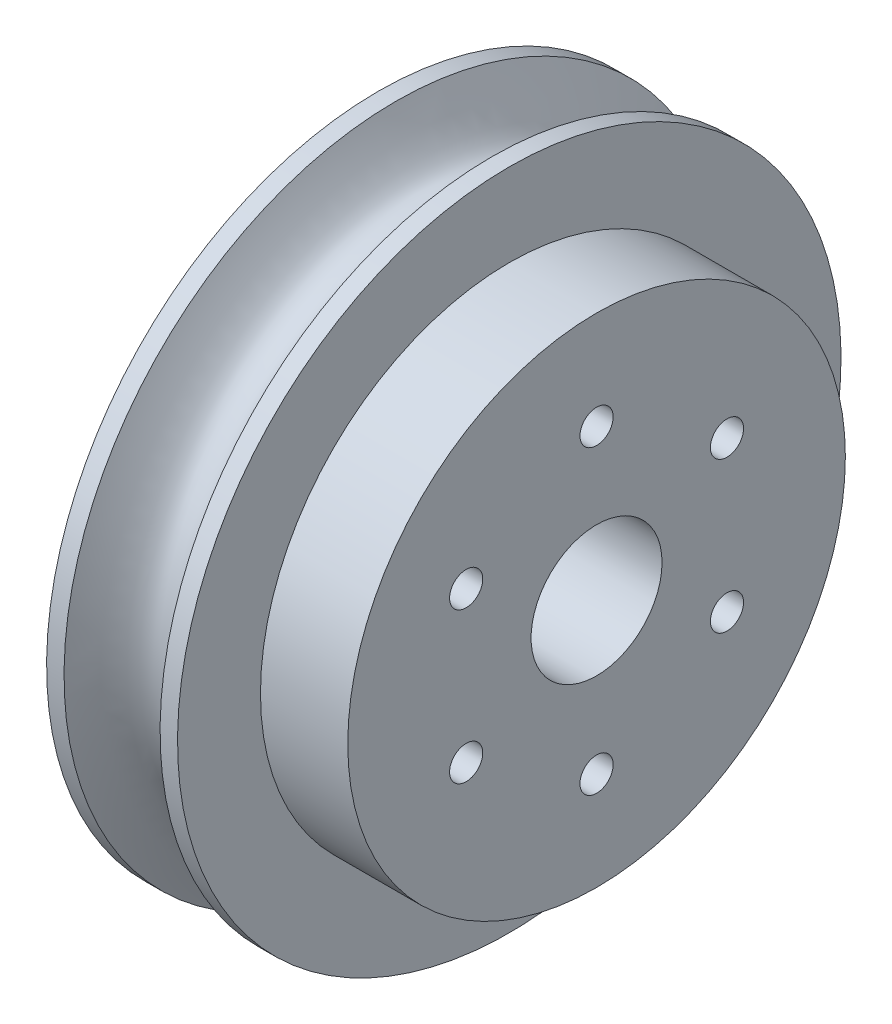
from build123d import *

# Parameters (mm, degrees)
SKETCH_1_R         = 28.5
SKETCH_1_R_2       = 1.9
SKETCH_1_R_3       = 7.5
EXTRUDE_1_DEPTH    = 10
SKETCH3_R          = 1.9
SKETCH3_R_2        = 7.5
CUT_EXTRUDE1_DEPTH = 60.270566179
SKETCH4_R          = 4
CUT_EXTRUDE2_DEPTH = 5


with BuildPart() as part:
    # 草图1 → 凸台-拉伸1 (new body)
    with BuildSketch(Plane(origin=(0, 0, 0), x_dir=(0, 0, -1), z_dir=(1, 0, 0))):
        Circle(SKETCH_1_R)
        with Locations((0, 17.25)):
            Circle(SKETCH_1_R_2, mode=Mode.SUBTRACT)
        with Locations((14.938938215, 8.625)):
            Circle(SKETCH_1_R_2, mode=Mode.SUBTRACT)
        with Locations((14.938938215, -8.625)):
            Circle(SKETCH_1_R_2, mode=Mode.SUBTRACT)
        with Locations((0, -17.25)):
            Circle(SKETCH_1_R_2, mode=Mode.SUBTRACT)
        with Locations((-14.938938215, -8.625)):
            Circle(SKETCH_1_R_2, mode=Mode.SUBTRACT)
        with Locations((-14.938938215, 8.625)):
            Circle(SKETCH_1_R_2, mode=Mode.SUBTRACT)
        Circle(SKETCH_1_R_3, mode=Mode.SUBTRACT)
    extrude(amount=EXTRUDE_1_DEPTH)

    # Sketch2 → Revolve1 (revolve)
    with BuildSketch(Plane.XY):
        with BuildLine():
            Line((0, 0), (-15, 0))
            Line((-15, 0), (-15, 38))
            Line((-15, 38), (-13, 38))
            add(Edge.make_bspline(
                [(-13, 38), (-9.977066976, 32.039576737), (-7.515495422, 32.019303811), (-5.003056497, 32.052880233), (-2, 38)],
                knots=[0.048051887, 0.048051887, 0.048051887, 0.048051887, 0.500504931, 0.951948113, 0.951948113, 0.951948113, 0.951948113], degree=3))
            Line((-2, 38), (0, 38))
            Line((0, 38), (0, 0))
        make_face()
    revolve(axis=Axis((0, 0, 0), (-1, 0, 0)))

    # Sketch3 → Cut-Extrude1 (cut, through all)
    with BuildSketch(Plane(origin=(10, 0, 0), x_dir=(0, 0, -1), z_dir=(1, 0, 0))):
        with Locations((14.938938215, 8.625)):
            Circle(SKETCH3_R)
        with Locations((14.938938215, -8.625)):
            Circle(SKETCH3_R)
        with Locations((0, -17.25)):
            Circle(SKETCH3_R)
        with Locations((-14.938938215, -8.625)):
            Circle(SKETCH3_R)
        with Locations((0, 17.25)):
            Circle(SKETCH3_R)
        with Locations((-14.938938215, 8.625)):
            Circle(SKETCH3_R)
        Circle(SKETCH3_R_2)
    extrude(amount=-CUT_EXTRUDE1_DEPTH, mode=Mode.SUBTRACT)

    # Sketch4 → Cut-Extrude2 (cut)
    with BuildSketch(Plane.ZY.offset(15)):
        with Locations(Location((14.938938215, 8.625, 0), (0, 0, 270))):
            Circle(SKETCH4_R)
        with Locations(Location((14.938938215, -8.625, 0), (0, 0, 270))):
            Circle(SKETCH4_R)
        with Locations(Location((0, -17.25, 0), (0, 0, 270))):
            Circle(SKETCH4_R)
        with Locations(Location((-14.938938215, -8.625, 0), (0, 0, 270))):
            Circle(SKETCH4_R)
        with Locations(Location((-14.938938215, 8.625, 0), (0, 0, 270))):
            Circle(SKETCH4_R)
        with Locations(Location((0, 17.25, 0), (0, 0, 270))):
            Circle(SKETCH4_R)
    extrude(amount=-CUT_EXTRUDE2_DEPTH, mode=Mode.SUBTRACT)


solid = part.part
